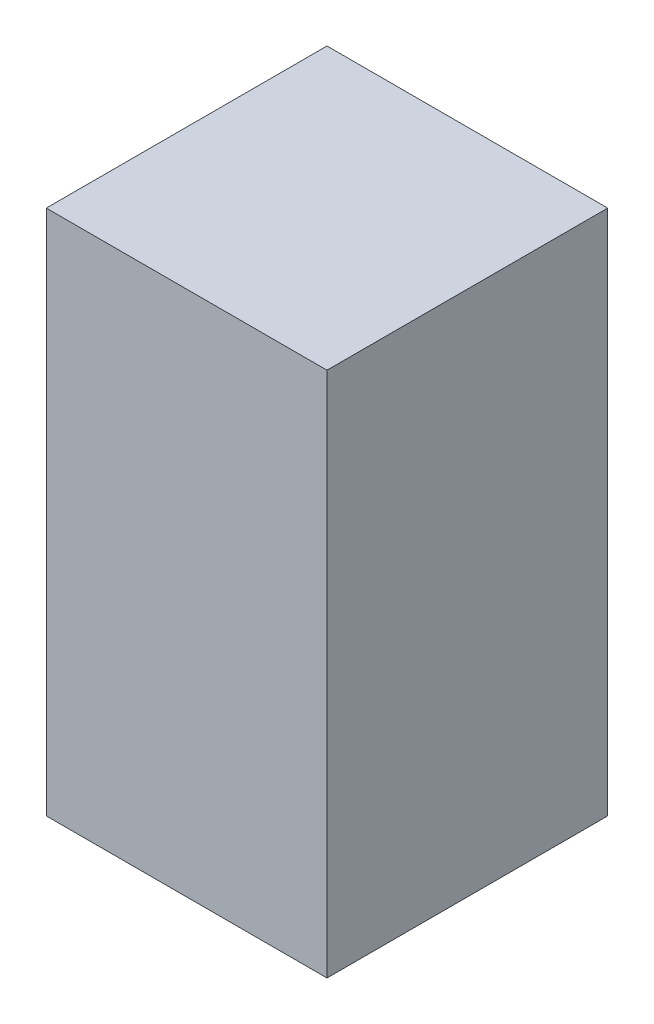
from build123d import *

# Parameters (mm, degrees)
SKETCH1_W           = 50.8
SKETCH1_H           = 50.8
BOSS_EXTRUDE2_DEPTH = 95.25


with BuildPart() as part:
    # Sketch1 → Boss-Extrude2 (new body)
    with BuildSketch(Plane(origin=(0, 0, 0), x_dir=(1, 0, 0), z_dir=(0, 1, 0))):
        with Locations((25.4, 9.030465093)):
            Rectangle(SKETCH1_W, SKETCH1_H)
    extrude(amount=BOSS_EXTRUDE2_DEPTH)


solid = part.part
